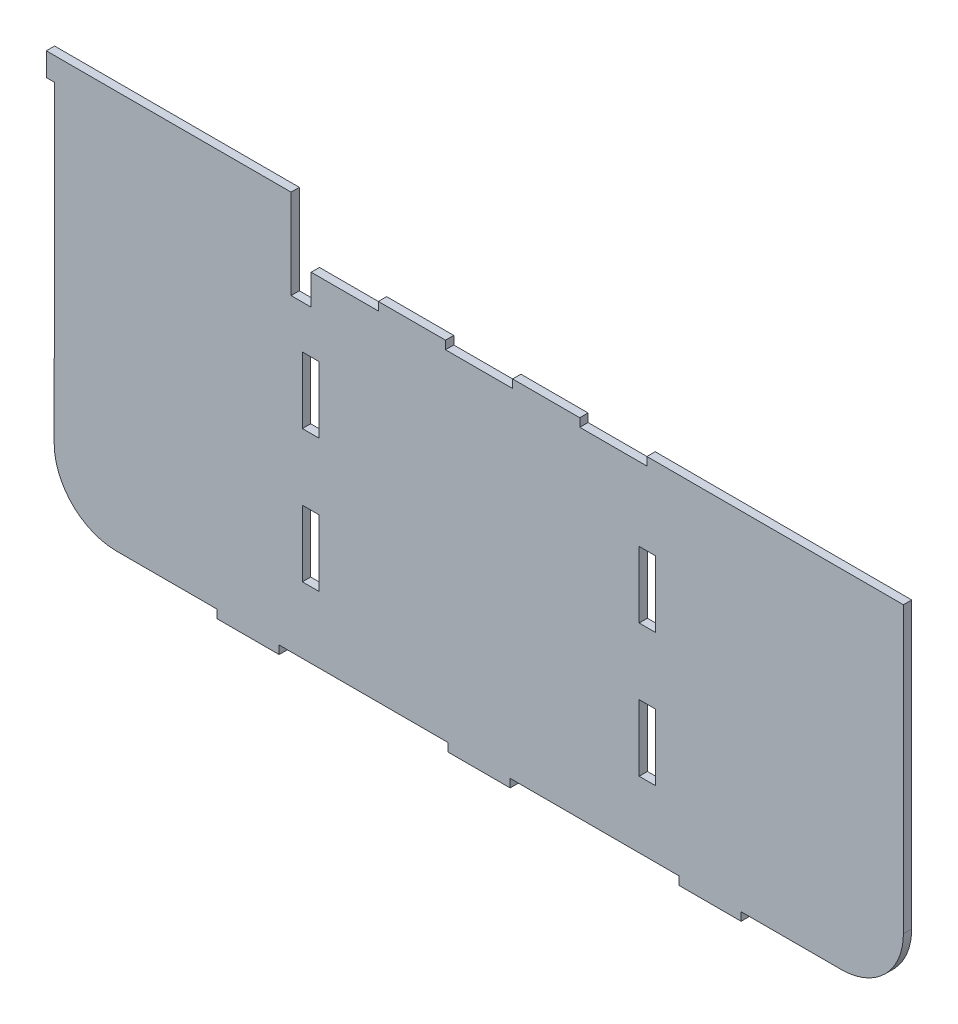
from build123d import *

# Parameters (mm, degrees)
SKETCH1_W           = 20.32
SKETCH1_H           = 81.316938585
BOSS_EXTRUDE1_DEPTH = 10.16


with BuildPart() as part:
    # Sketch1 → Boss-Extrude1 (new body)
    with BuildSketch(Plane.XY):
        with BuildLine():
            Line((-444.5, 10.16), (-321.2, 10.16))
            Line((-321.2, 10.16), (-321.2, 0))
            Line((-321.2, 0), (-245, 0))
            Line((-245, 0), (-245, 10.16))
            Line((-245, 10.16), (-38.1, 10.16))
            Line((-38.1, 10.16), (-38.1, 0))
            Line((-38.1, 0), (38.1, 0))
            Line((38.1, 0), (38.1, 10.16))
            Line((38.1, 10.16), (245, 10.16))
            Line((245, 10.16), (245, 0))
            Line((245, 0), (321.2, 0))
            Line((321.2, 0), (321.2, 10.16))
            Line((321.2, 10.16), (444.500003861, 10.16))
            add(Edge.make_bspline(
                [(444.500003861, 10.16), (519.890985801, 10.806562601), (520.046520423, 86.2)],
                knots=[4.720964914, 4.720964914, 4.720964914, 6.281122341, 6.281122341, 6.281122341], degree=2, weights=[1, 0.710858178, 1]))
            Line((520.046520423, 86.2), (520.070316185, 435.449980504))
            Line((520.070316185, 435.449980504), (205.706405146, 435.61))
            Line((205.706405146, 435.61), (205.558012439, 425.45))
            Line((205.558012439, 425.45), (123.444, 425.45))
            Line((123.444, 425.45), (123.444, 435.61))
            Line((123.444, 435.61), (41.148, 435.61))
            Line((41.148, 435.61), (41.148, 425.45))
            Line((41.148, 425.45), (-41.148, 425.45))
            Line((-41.148, 425.45), (-41.148, 435.61))
            Line((-41.148, 435.61), (-123.444, 435.61))
            Line((-123.444, 435.61), (-123.444, 425.45))
            Line((-123.444, 425.45), (-205.74, 425.45))
            Line((-205.74, 425.45), (-205.74, 388.35))
            Line((-205.74, 388.35), (-230.359692718, 388.35))
            Line((-230.359692718, 388.35), (-230.359692718, 498.154928973))
            Line((-230.359692718, 498.154928973), (-530.359692718, 498.154928973))
            Line((-530.359692718, 498.154928973), (-530.359692718, 469.654928973))
            Line((-530.359692718, 469.654928973), (-520.360110714, 469.746360594))
            Line((-520.360110714, 469.746360594), (-520.360110714, 435.61))
            Line((-520.360110714, 435.61), (-520.7, 86.36))
            ThreePointArc((-520.7, 86.36), (-498.381536726, 32.478463274), (-444.5, 10.16))
        make_face()
        with Locations((206.375268781, 132.135407878)):
            Rectangle(SKETCH1_W, SKETCH1_H, mode=Mode.SUBTRACT)
        with Locations((206.375268781, 294.769285048)):
            Rectangle(SKETCH1_W, SKETCH1_H, mode=Mode.SUBTRACT)
        with Locations((-206.375268781, 132.135407878)):
            Rectangle(SKETCH1_W, SKETCH1_H, mode=Mode.SUBTRACT)
        with Locations((-206.375268781, 294.769285048)):
            Rectangle(SKETCH1_W, SKETCH1_H, mode=Mode.SUBTRACT)
    extrude(amount=BOSS_EXTRUDE1_DEPTH)


solid = part.part
